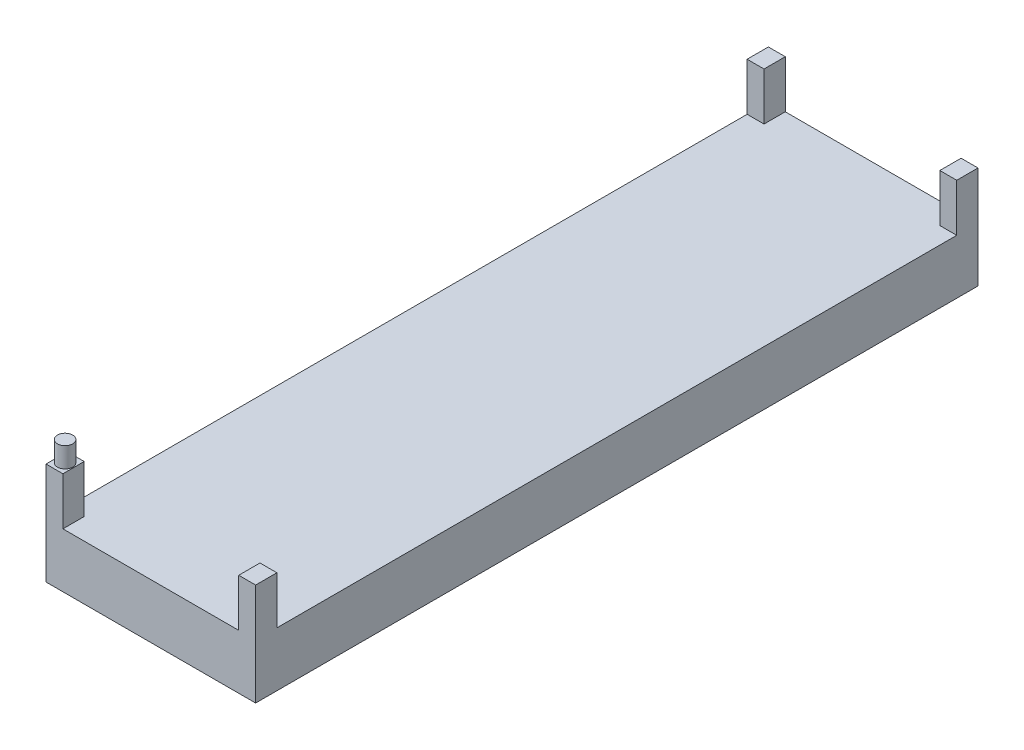
from build123d import *

# Parameters (mm, degrees)
SKETCH1_W           = 97.663
SKETCH1_H           = 336.55
BASE_DEPTH          = 25.4
SKETCH2_W           = 7.874
SKETCH2_H           = 9.906
BOSS_EXTRUDE2_DEPTH = 22.225
SKETCH3_R           = 3.556
BOSS_EXTRUDE3_DEPTH = 9.398


with BuildPart() as part:
    # Sketch1 → Base (new body)
    with BuildSketch(Plane(origin=(0, 0, 0), x_dir=(1, 0, 0), z_dir=(0, 1, 0))):
        Rectangle(SKETCH1_W, SKETCH1_H)
    extrude(amount=BASE_DEPTH)

    # Sketch2 → Boss-Extrude2 (add)
    with BuildSketch(Plane(origin=(0, 25.4, 0), x_dir=(1, 0, 0), z_dir=(0, 1, 0))):
        with Locations((-44.8945, -163.322)):
            Rectangle(SKETCH2_W, SKETCH2_H)
        with Locations((44.8945, -163.322)):
            Rectangle(SKETCH2_W, SKETCH2_H)
        with Locations((44.8945, 163.322)):
            Rectangle(SKETCH2_W, SKETCH2_H)
        with Locations((-44.8945, 163.322)):
            Rectangle(SKETCH2_W, SKETCH2_H)
    extrude(amount=BOSS_EXTRUDE2_DEPTH)

    # Sketch3 → Boss-Extrude3 (add)
    with BuildSketch(Plane(origin=(0, 47.625, 0), x_dir=(1, 0, 0), z_dir=(0, 1, 0))):
        with Locations(Location((-44.8945, -163.322, 0), (0, 0, 90))):
            Circle(SKETCH3_R)
    extrude(amount=BOSS_EXTRUDE3_DEPTH)


solid = part.part
